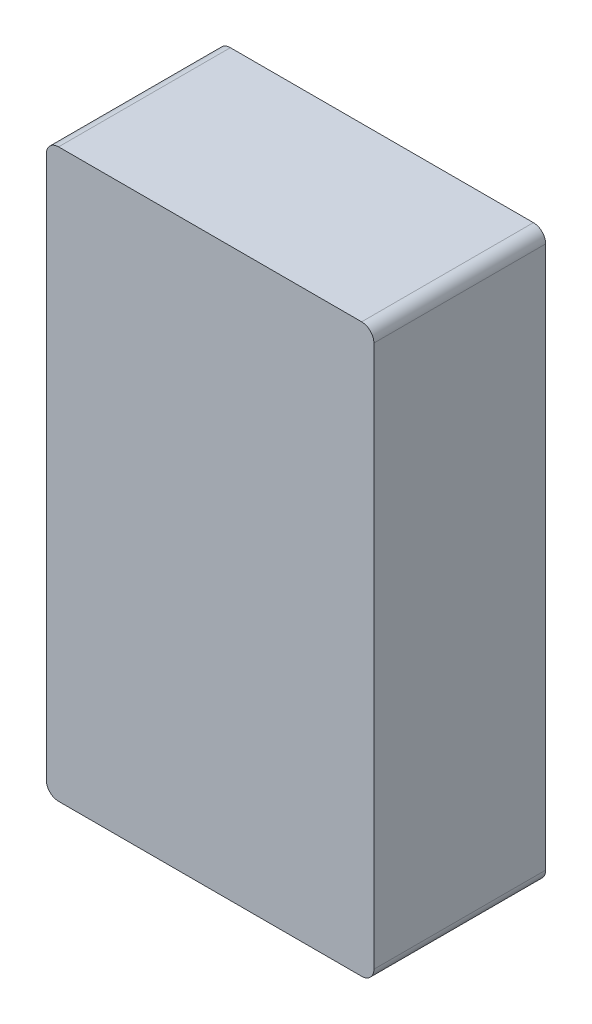
from build123d import *

# Parameters (mm, degrees)
ESQUISSE1_W        = 26.7
ESQUISSE1_H        = 46.2
BOSS_EXTRU_1_DEPTH = 14
CONG_1_R           = 1


with BuildPart() as part:
    # Esquisse1 → Boss.-Extru.1 (new body)
    with BuildSketch(Plane.XY):
        Rectangle(ESQUISSE1_W, ESQUISSE1_H)
    extrude(amount=BOSS_EXTRU_1_DEPTH)

    # Congé1
    cong_1_edges = [part.edges().sort_by_distance(p)[0] for p in [
        (-13.35, 23.1, 7),
        (13.35, 23.1, 7),
        (13.35, -23.1, 7),
        (-13.35, -23.1, 7),
    ]]
    fillet(cong_1_edges, radius=CONG_1_R)


solid = part.part
